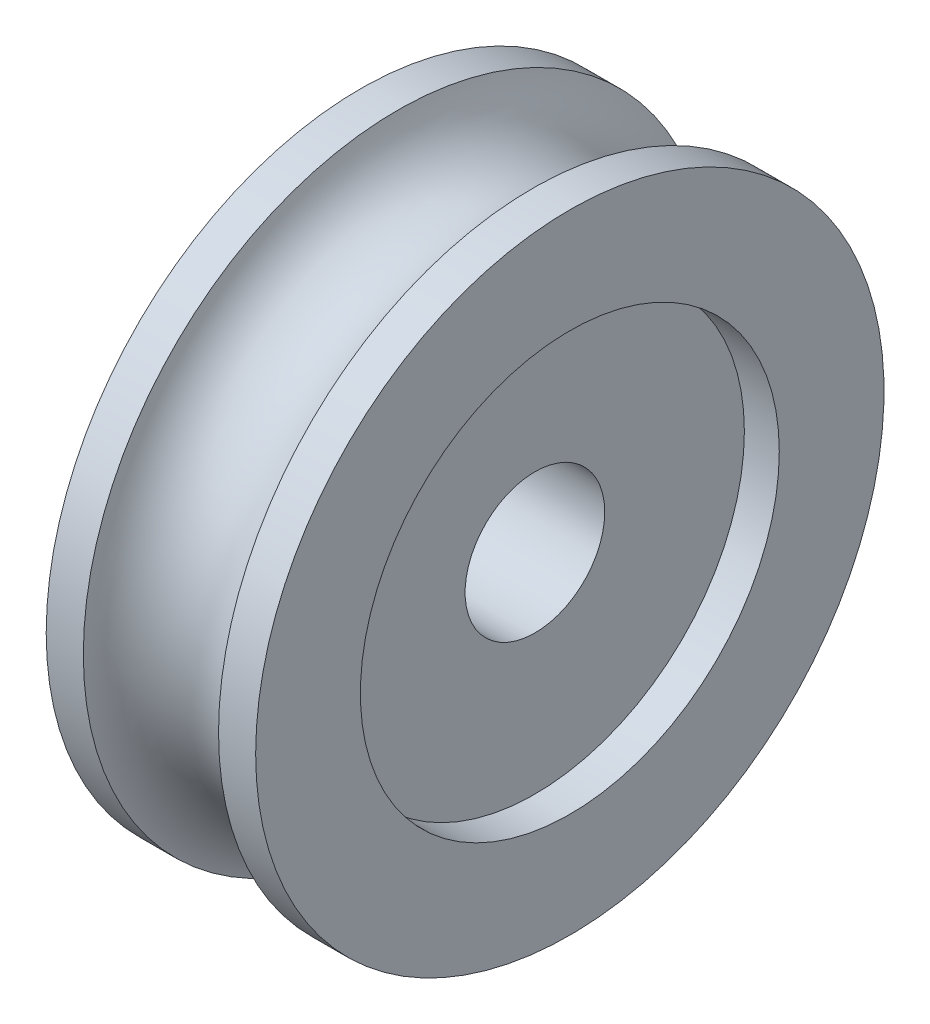
from build123d import *

# Parameters (mm, degrees)
SKETCH_2_R          = 2
CUT_EXTRUDE_1_DEPTH = 55
SKETCH_3_R          = 6
CUT_EXTRUDE_2_DEPTH = 1
CUT_EXTRUDE_START   = -1
SKETCH_4_R          = 6
CUT_EXTRUDE_3_DEPTH = 1


with BuildPart() as part:
    # 草图1 → 旋转1 (revolve)
    with BuildSketch(Plane(origin=(0, 0, 0), x_dir=(1, 0, 0), z_dir=(0, 1, 0)), mode=Mode.PRIVATE) as revolve_1_sk:
        with BuildLine():
            Line((-3, 4.5), (-3, -4.5))
            Line((-3, -4.5), (3, -4.5))
            Line((3, -4.5), (3, 4.5))
            Line((3, 4.5), (1.936491673, 4.5))
            ThreePointArc((1.936491673, 4.5), (0, 3), (-1.936491673, 4.5))
            Line((-1.936491673, 4.5), (-3, 4.5))
        make_face()
    revolve(revolve_1_sk.sketch.rotate(Axis((-3, 0, 4.5), (1, 0, 0)), 180), axis=Axis((-3, 0, 4.5), (1, 0, 0)))

    # 草图2 → 切除-拉伸1 (cut)
    with BuildSketch(Plane(origin=(3, 0, 0), x_dir=(0, 0, -1), z_dir=(1, 0, 0))):
        with Locations((-4.5, 0)):
            Circle(SKETCH_2_R)
    extrude(amount=-CUT_EXTRUDE_1_DEPTH, mode=Mode.SUBTRACT)

    # 草图3 → 切除-拉伸2 (cut)
    with BuildSketch(Plane(origin=(3, 0, 0), x_dir=(0, 0, -1), z_dir=(1, 0, 0))):
        with Locations((-4.5, 0)):
            Circle(SKETCH_3_R)
    extrude(amount=-CUT_EXTRUDE_2_DEPTH, mode=Mode.SUBTRACT)

    # 草图4 → 切除-拉伸3 (cut)
    with BuildSketch(Plane.ZY.offset(3).offset(CUT_EXTRUDE_START)):
        with Locations(Location((4.5, 0, 0), (0, 0, 180))):
            Circle(SKETCH_4_R)
    extrude(amount=CUT_EXTRUDE_3_DEPTH, mode=Mode.SUBTRACT)


solid = part.part
